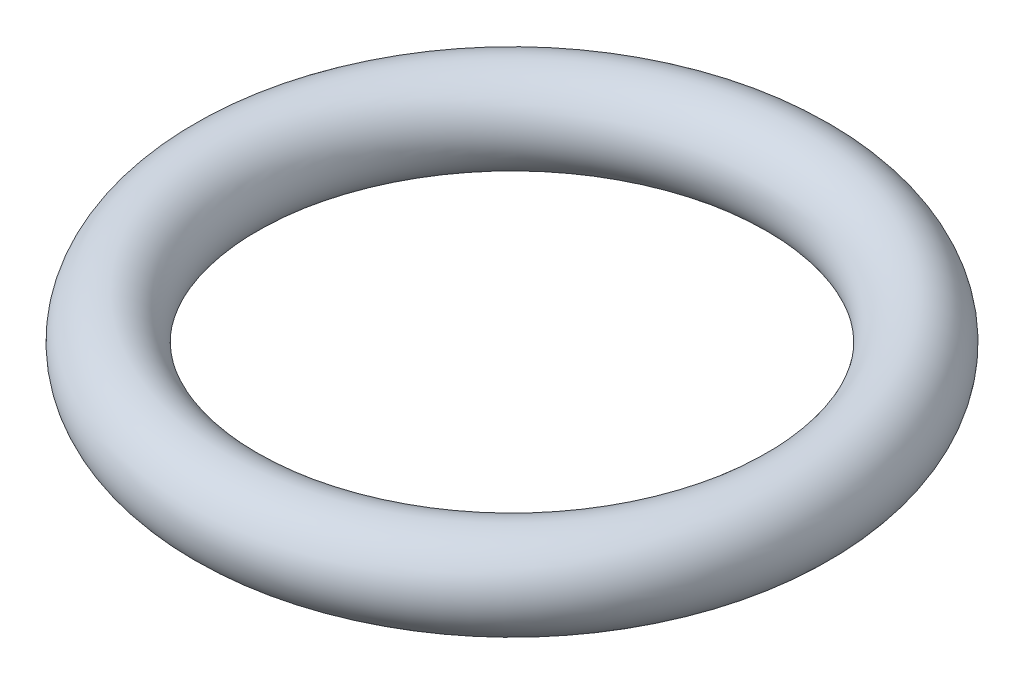
from build123d import *

# Parameters (mm, degrees)
SKETCH1_R = 2


with BuildPart() as part:
    # Sketch1 → Revolve1 (revolve)
    with BuildSketch(Plane(origin=(0, 0, 0), x_dir=(0, 0, -1), z_dir=(1, 0, 0))):
        with Locations((-13, 0)):
            Circle(SKETCH1_R)
    revolve(axis=Axis((0, 0, 0), (0, 1, 0)))


solid = part.part
